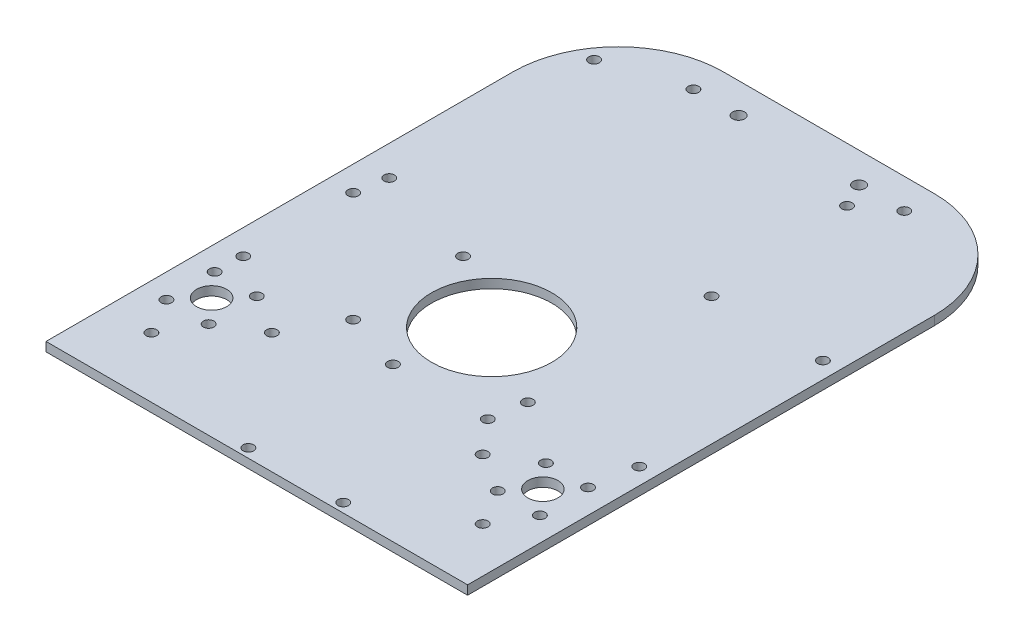
from build123d import *

# Parameters (mm, degrees)
SKETCH_1_W          = 140
SKETCH_1_H          = 220
SKETCH_1_R          = 1.75
SKETCH_1_R_2        = 20
EXTRUDE_1_DEPTH     = 3
SKETCH_2_R          = 1.75
SKETCH_2_R_2        = 2
SKETCH_2_R_3        = 5
CUT_EXTRUDE_1_DEPTH = 131.418556962
SKETCH_3_R          = 1.75
CUT_EXTRUDE_2_DEPTH = 131.418556962
CUT_EXTRUDE_3_DEPTH = 131.418556962


with BuildPart() as part:
    # 草图1 → 凸台-拉伸1 (new body)
    with BuildSketch(Plane(origin=(0, 0, 0), x_dir=(1, 0, 0), z_dir=(0, 1, 0))):
        Rectangle(SKETCH_1_W, SKETCH_1_H)
        with Locations(Location((-5.8, -59, 0), (0, 0, 270))):
            Circle(SKETCH_1_R, mode=Mode.SUBTRACT)
        with Locations(Location((25.7, -59, 0), (0, 0, 270))):
            Circle(SKETCH_1_R, mode=Mode.SUBTRACT)
        with Locations(Location((-5.8, -107, 0), (0, 0, 270))):
            Circle(SKETCH_1_R, mode=Mode.SUBTRACT)
        with Locations(Location((25.7, -107, 0), (0, 0, 270))):
            Circle(SKETCH_1_R, mode=Mode.SUBTRACT)
        with Locations(Location((0, -32, 0), (0, 0, 270))):
            Circle(SKETCH_1_R_2, mode=Mode.SUBTRACT)
    extrude(amount=EXTRUDE_1_DEPTH)

    # 草图2 → 切除-拉伸1 (cut, through all)
    with BuildSketch(Plane(origin=(0, 3, 0), x_dir=(1, 0, 0), z_dir=(0, 1, 0))):
        with Locations(Location((48, -62, 0), (0, 0, 270))):
            Circle(SKETCH_2_R)
        with Locations(Location((62, -62, 0), (0, 0, 270))):
            Circle(SKETCH_2_R)
        with Locations(Location((62, -78, 0), (0, 0, 270))):
            Circle(SKETCH_2_R)
        with Locations(Location((48, -78, 0), (0, 0, 270))):
            Circle(SKETCH_2_R)
        with Locations(Location((-62, -78, 0), (0, 0, 90))):
            Circle(SKETCH_2_R)
        with Locations(Location((-48, -78, 0), (0, 0, 90))):
            Circle(SKETCH_2_R)
        with Locations(Location((-62, -62, 0), (0, 0, 90))):
            Circle(SKETCH_2_R)
        with Locations(Location((-48, -62, 0), (0, 0, 90))):
            Circle(SKETCH_2_R)
        with Locations(Location((-35, 70, 0), (0, 0, 270))):
            Circle(SKETCH_2_R)
        with Locations(Location((-35, -70, 0), (0, 0, 270))):
            Circle(SKETCH_2_R)
        with Locations(Location((35, -70, 0), (0, 0, 270))):
            Circle(SKETCH_2_R)
        with Locations(Location((35, 70, 0), (0, 0, 270))):
            Circle(SKETCH_2_R)
        with Locations(Location((-20, 70, 0), (0, 0, 270))):
            Circle(SKETCH_2_R_2)
        with Locations(Location((20, 70, 0), (0, 0, 270))):
            Circle(SKETCH_2_R_2)
        with Locations(Location((55, -70, 0), (0, 0, 270))):
            Circle(SKETCH_2_R_3)
        with Locations(Location((-55, -70, 0), (0, 0, 90))):
            Circle(SKETCH_2_R_3)
    extrude(amount=-CUT_EXTRUDE_1_DEPTH, mode=Mode.SUBTRACT)

    # 草图3 → 切除-拉伸2 (cut, through all)
    with BuildSketch(Plane(origin=(0, 3, 0), x_dir=(1, 0, 0), z_dir=(0, 1, 0))):
        with Locations(Location((55, -90, 0), (0, 0, 270))):
            Circle(SKETCH_3_R)
        with Locations(Location((-55, -90, 0), (0, 0, 270))):
            Circle(SKETCH_3_R)
        with Locations(Location((64.5, -47.5, 0), (0, 0, 270))):
            Circle(SKETCH_3_R)
        with Locations(Location((27.5, -47.5, 0), (0, 0, 270))):
            Circle(SKETCH_3_R)
        with Locations(Location((64.5, 13.5, 0), (0, 0, 270))):
            Circle(SKETCH_3_R)
        with Locations(Location((27.5, 13.5, 0), (0, 0, 270))):
            Circle(SKETCH_3_R)
        with Locations(Location((-25.25, -52.75, 0), (0, 0, 270))):
            Circle(SKETCH_3_R)
        with Locations(Location((-61.75, -16.25, 0), (0, 0, 270))):
            Circle(SKETCH_3_R)
        with Locations(Location((-25.25, -16.25, 0), (0, 0, 270))):
            Circle(SKETCH_3_R)
        with Locations(Location((-60, -6, 0), (0, 0, 270))):
            Circle(SKETCH_3_R)
        with Locations(Location((24, 62, 0), (0, 0, 270))):
            Circle(SKETCH_3_R)
        with Locations(Location((-60, 62, 0), (0, 0, 270))):
            Circle(SKETCH_3_R)
        with Locations(Location((-61.75, -52.75, 0), (0, 0, 270))):
            Circle(SKETCH_3_R)
    extrude(amount=-CUT_EXTRUDE_2_DEPTH, mode=Mode.SUBTRACT)

    # 草图5 → 切除-拉伸3 (cut, through all)
    with BuildSketch(Plane(origin=(0, 3, 0), x_dir=(1, 0, 0), z_dir=(0, 1, 0))):
        with BuildLine():
            Line((-35, 80), (35, 80))
            ThreePointArc((35, 80), (59.748737342, 69.748737342), (70, 45))
            Line((70, 45), (70, 110))
            Line((70, 110), (-70, 110))
            Line((-70, 110), (-70, 45))
            ThreePointArc((-70, 45), (-59.748737342, 69.748737342), (-35, 80))
        make_face()
    extrude(amount=-CUT_EXTRUDE_3_DEPTH, mode=Mode.SUBTRACT)


solid = part.part
